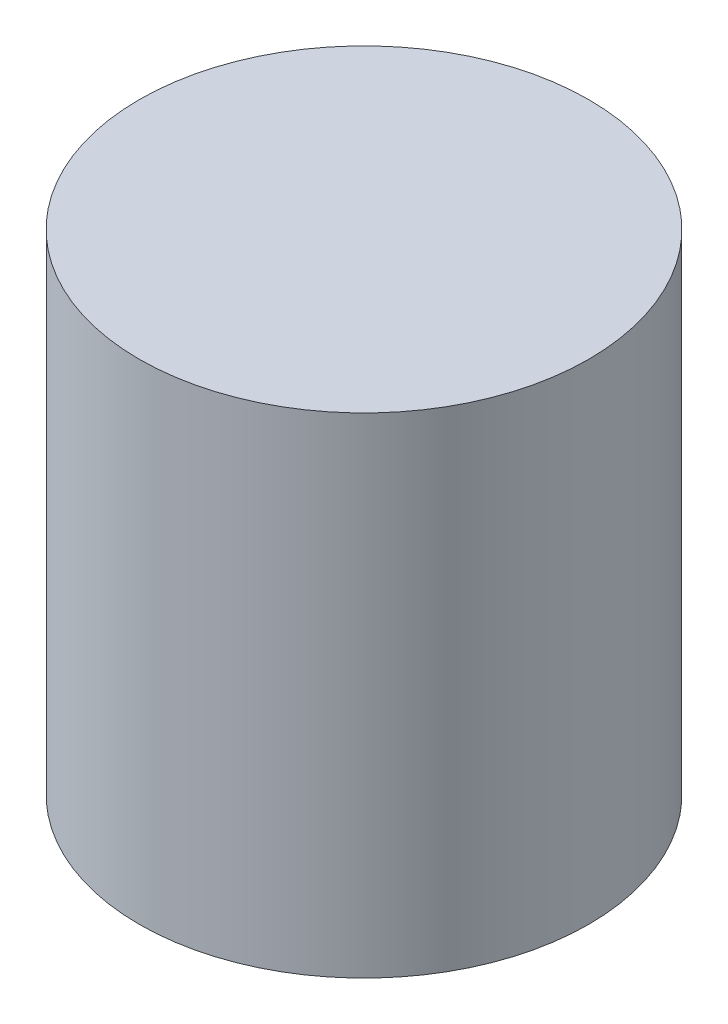
from build123d import *

# Parameters (mm, degrees)
SKETCH1_R           = 2.7559
BOSS_EXTRUDE1_DEPTH = 3.7
BOSS_EXTRUDE2_START = 3.7
SKETCH1_3_R         = 2.7559
BOSS_EXTRUDE2_DEPTH = 2.3


with BuildPart() as part:
    # Sketch1 → Boss-Extrude1 (new body)
    with BuildSketch(Plane(origin=(0, 0, 0), x_dir=(1, 0, 0), z_dir=(0, 1, 0))):
        with Locations(Location((0, 0, 0), (0, 0, 270))):
            Circle(SKETCH1_R)
        Polygon((-2.05, -0.585), (-2.05, 0.585), (-0.585, 0.585), (-0.585, 2.05), (0.585, 2.05), (0.585, 0.585), (2.05, 0.585), (2.05, -0.585), (0.585, -0.585), (0.585, -2.05), (-0.585, -2.05), (-0.585, -0.585), align=None, mode=Mode.SUBTRACT)
    extrude(amount=BOSS_EXTRUDE1_DEPTH)

    # Sketch1<3> → Boss-Extrude2 (add)
    with BuildSketch(Plane(origin=(0, 0, 0), x_dir=(1, 0, 0), z_dir=(0, 1, 0)).offset(BOSS_EXTRUDE2_START)):
        with Locations(Location((0, 0, 0), (0, 0, 270))):
            Circle(SKETCH1_3_R)
    extrude(amount=BOSS_EXTRUDE2_DEPTH)


solid = part.part
